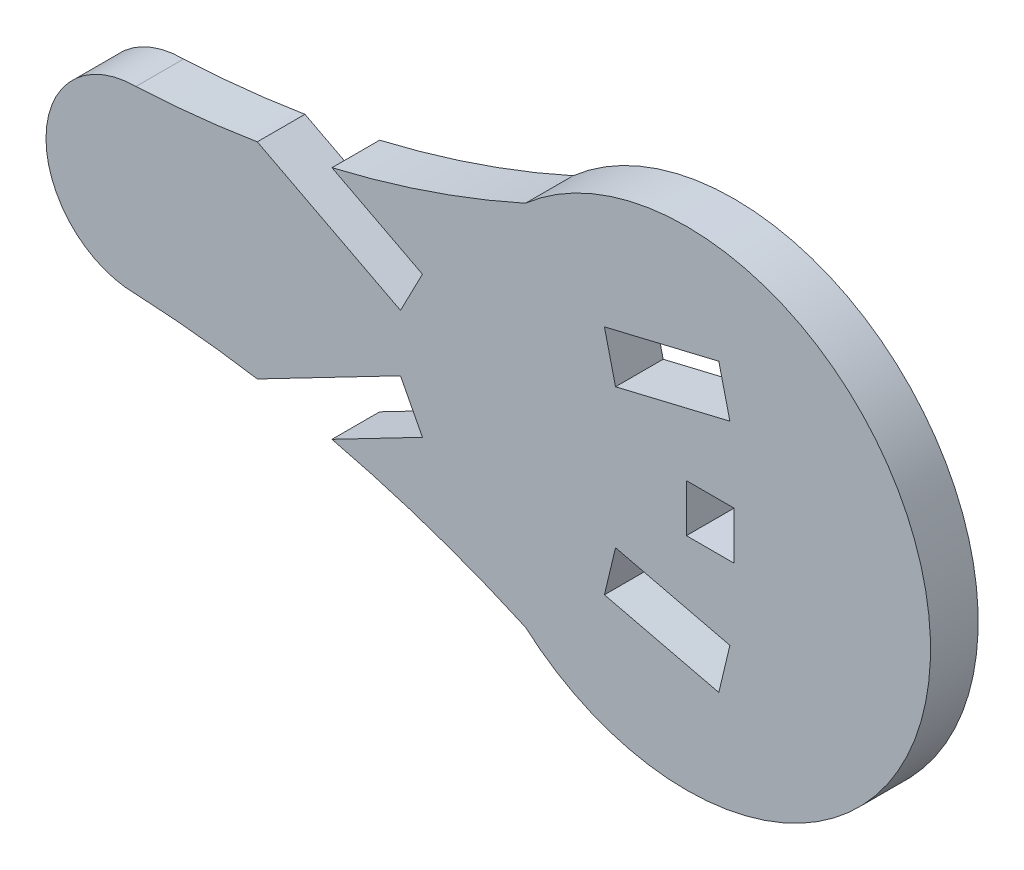
from build123d import *

# Parameters (mm, degrees)
SKETCH1_W           = 1.524
SKETCH1_H           = 1.524
BOSS_EXTRUDE1_DEPTH = 1.524
CUT_EXTRUDE1_DEPTH  = 2.54
CUT_EXTRUDE2_DEPTH  = 2.54


with BuildPart() as part:
    # Sketch1 → Boss-Extrude1 (new body)
    with BuildSketch(Plane.XY):
        with BuildLine():
            ThreePointArc((-5.144991791, -6.632201856), (7.805780573, -0.762), (-5.144991791, 5.108201856))
            ThreePointArc((-5.144991791, 5.108201856), (-11.231180242, 3.023042691), (-17.599967494, 2.113027551))
            ThreePointArc((-17.599967494, 2.113027551), (-20.474995045, -0.762), (-17.599967494, -3.637027551))
            ThreePointArc((-17.599967494, -3.637027551), (-11.231180242, -4.547042691), (-5.144991791, -6.632201856))
        make_face()
        with Locations((0.762, -0.762)):
            Rectangle(SKETCH1_W, SKETCH1_H, mode=Mode.SUBTRACT)
    extrude(amount=-BOSS_EXTRUDE1_DEPTH)

    # Sketch2 → Cut-Extrude1 (cut)
    with BuildSketch(Plane.XY):
        Polygon((-9.141246891, -1.667471429), (-13.932743082, -4.156077978), (-13.230301809, -5.508539533), (-8.438805618, -3.019932984), align=None)
        Polygon((-13.932743082, 2.632077978), (-13.230301809, 3.984539533), (-8.438805618, 1.495932984), (-9.141246891, 0.143471429), align=None)
    extrude(amount=-CUT_EXTRUDE1_DEPTH, mode=Mode.SUBTRACT)

    # Sketch3 → Cut-Extrude2 (cut)
    with BuildSketch(Plane.XY):
        Polygon((1.03592119, 3.823335546), (1.390623256, 2.34118763), (-2.266113377, 1.466071171), (-2.620815442, 2.948219087), align=None)
        Polygon((-2.620815442, -4.472219087), (1.03592119, -5.347335546), (1.390623256, -3.86518763), (-2.266113377, -2.990071171), align=None)
    extrude(amount=-CUT_EXTRUDE2_DEPTH, mode=Mode.SUBTRACT)


solid = part.part
